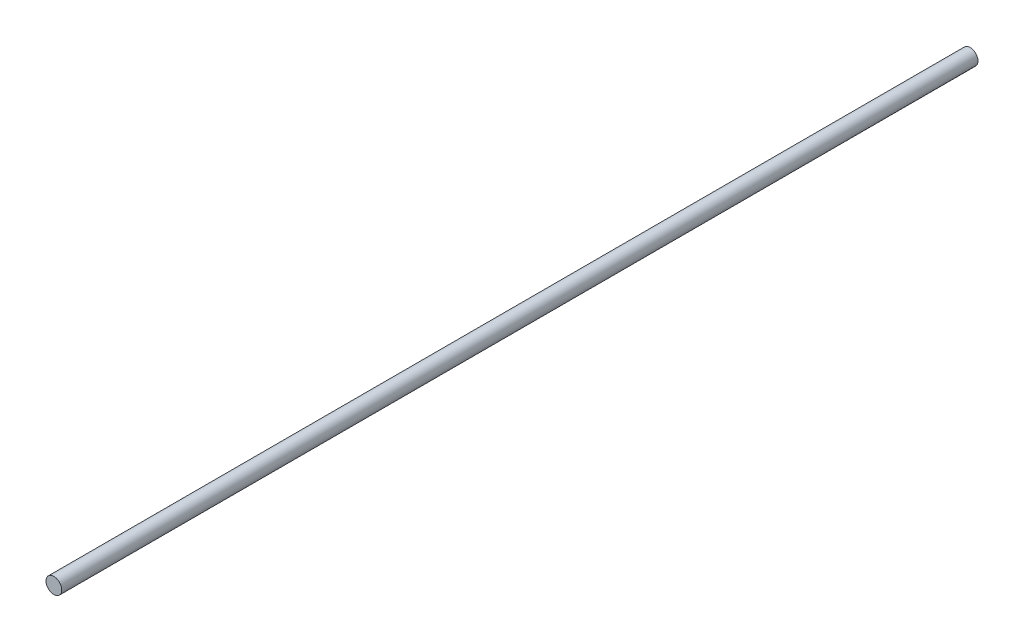
from build123d import *

# Parameters (mm, degrees)
SKETCH_1_R      = 3
EXTRUDE_1_DEPTH = 349.4


with BuildPart() as part:
    # 草图1 → 凸台-拉伸1 (new body)
    with BuildSketch(Plane.XY):
        Circle(SKETCH_1_R)
    extrude(amount=EXTRUDE_1_DEPTH)


solid = part.part
